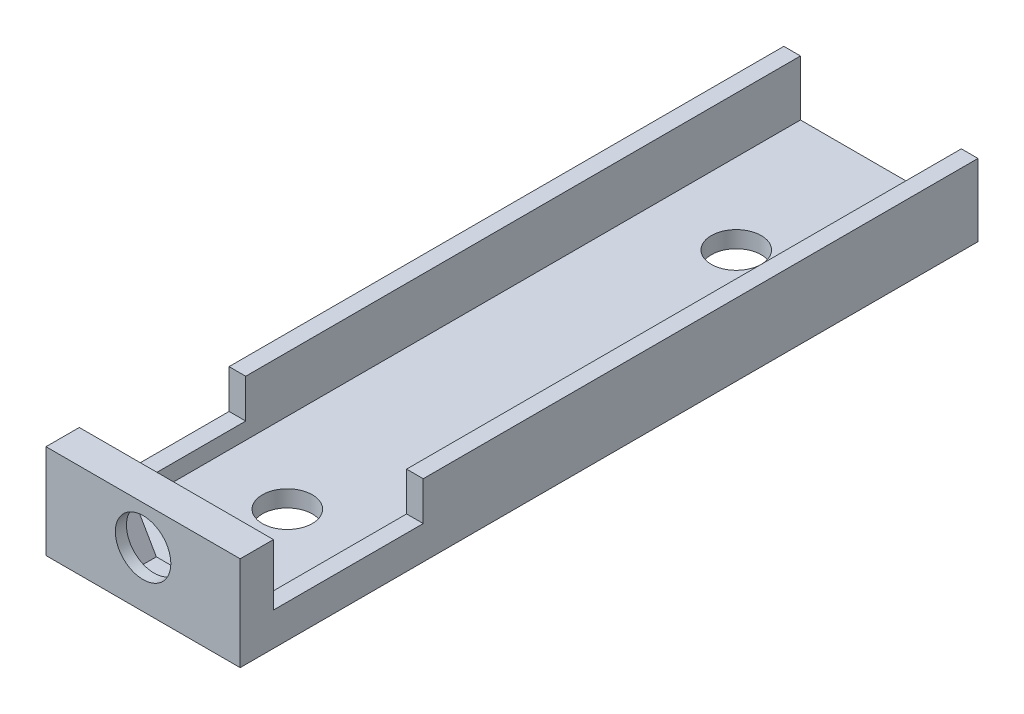
from build123d import *

# Parameters (mm, degrees)
BOSS_EXTRUDE1_DEPTH = 100
BOSS_EXTRUDE2_DEPTH = 31
SKETCH3_W           = 35
SKETCH3_H           = 17
BOSS_EXTRUDE3_DEPTH = 4
SKETCH4_R           = 4.5
CUT_EXTRUDE1_DEPTH  = 137.315809795
SKETCH3_4_W         = 35
SKETCH3_4_H         = 17
SKETCH3_4_R         = 5
BOSS_EXTRUDE4_DEPTH = 2


with BuildPart() as part:
    # Sketch1 → Boss-Extrude1 (new body)
    with BuildSketch(Plane.XY):
        Polygon((0, 0), (0, 13), (3, 13), (3, 3), (32, 3), (32, 13), (35, 13), (35, 0), align=None)
    extrude(amount=BOSS_EXTRUDE1_DEPTH)

    # Sketch2 → Boss-Extrude2 (add)
    with BuildSketch(Plane.XY.offset(100)):
        Polygon((3, 6), (3, 3), (32, 3), (32, 6), (35, 6), (35, 0), (0, 0), (0, 6), align=None)
    extrude(amount=BOSS_EXTRUDE2_DEPTH)

    # Sketch3 → Boss-Extrude3 (add)
    with BuildSketch(Plane.XY.offset(131)):
        with Locations((17.5, 8.5)):
            Rectangle(SKETCH3_W, SKETCH3_H)
        Polygon((13.891560818, 16.25), (21.108439182, 16.25), (24.716878365, 10), (21.108439182, 3.75), (13.891560818, 3.75), (10.283121635, 10), align=None, mode=Mode.SUBTRACT)
    extrude(amount=-BOSS_EXTRUDE3_DEPTH)

    # Sketch4 → Cut-Extrude1 (cut, through all)
    with BuildSketch(Plane(origin=(0, 3, 0), x_dir=(1, 0, 0), z_dir=(0, 1, 0))):
        with Locations((17.5, -107)):
            Circle(SKETCH4_R)
        with Locations((17.5, -26.075)):
            Circle(SKETCH4_R)
    extrude(amount=-CUT_EXTRUDE1_DEPTH, mode=Mode.SUBTRACT)

    # Sketch3<4> → Boss-Extrude4 (add)
    with BuildSketch(Plane.XY.offset(131)):
        with Locations((17.5, 8.5)):
            Rectangle(SKETCH3_4_W, SKETCH3_4_H)
        with Locations((17.5, 10)):
            Circle(SKETCH3_4_R, mode=Mode.SUBTRACT)
    extrude(amount=BOSS_EXTRUDE4_DEPTH)


solid = part.part
